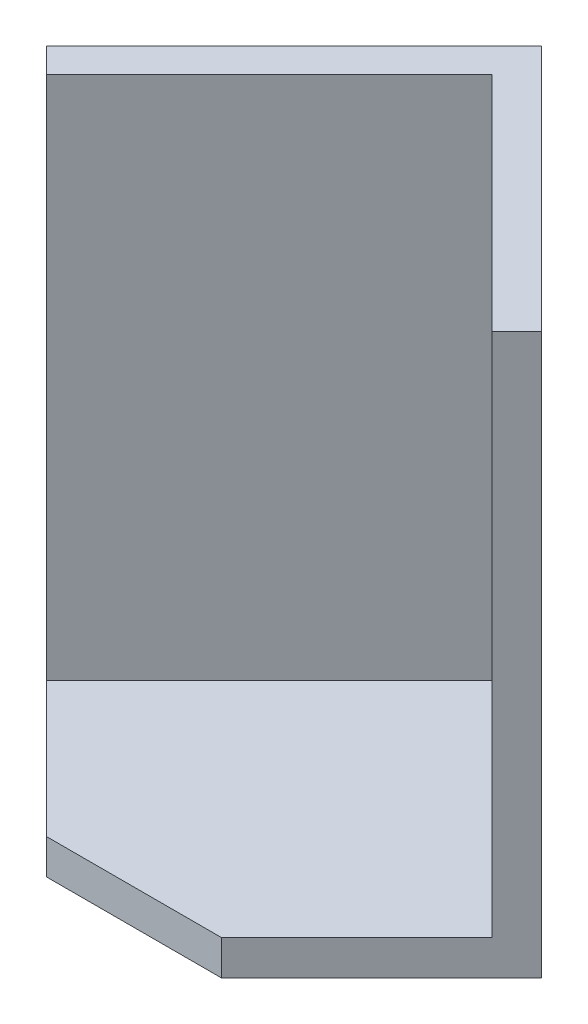
from build123d import *

# Parameters (mm, degrees)
BOSS_EXTRUDE1_DEPTH = 80
BOSS_EXTRUDE2_DEPTH = 10


with BuildPart() as part:
    # Sketch1 → Boss-Extrude1 (new, symmetric)
    with BuildSketch(Plane(origin=(0, 0, 0), x_dir=(1, 0, 0), z_dir=(0, 1, 0))):
        Polygon((0, -40.082250377), (70.710678119, -110.792928496), (63.639610307, -117.863996308), (0, -54.224386001), (-63.639610307, -117.863996308), (-70.710678119, -110.792928496), align=None)
    extrude(amount=BOSS_EXTRUDE1_DEPTH, both=True)

    # Sketch2 → Boss-Extrude2 (add)
    with BuildSketch(Plane.XZ.offset(80)):
        Polygon((-63.639610307, 117.863996308), (0, 54.224386001), (63.639610307, 117.863996308), (25, 156.503606614), (-25, 156.503606614), align=None)
    extrude(amount=-BOSS_EXTRUDE2_DEPTH)


solid = part.part
